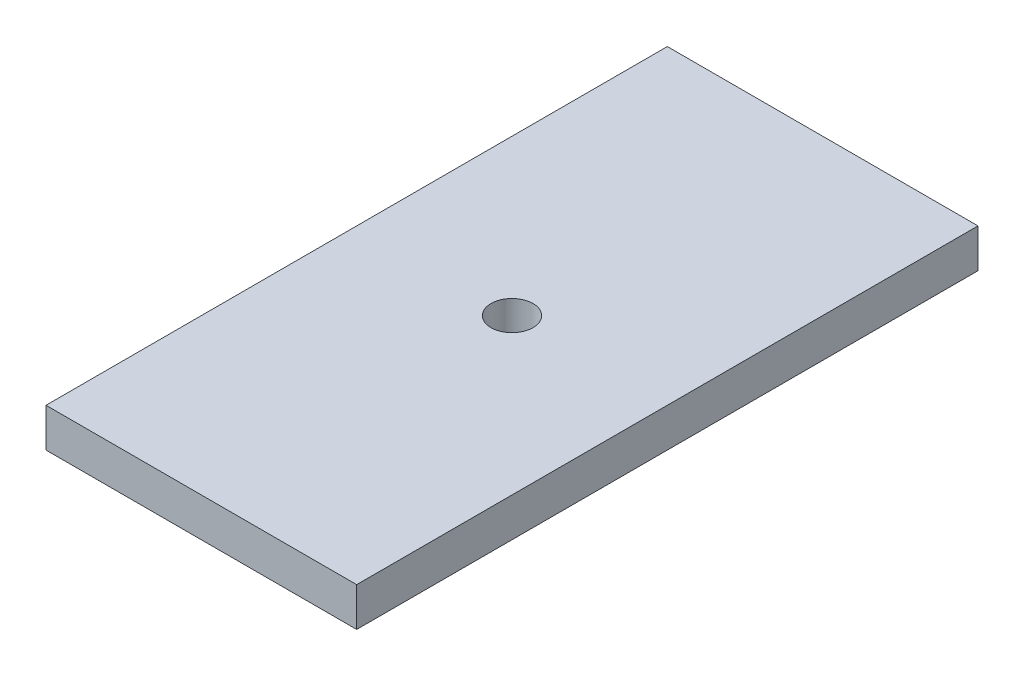
from build123d import *

# Parameters (mm, degrees)
SKETCH1_W           = 50.8
SKETCH1_H           = 101.6
SKETCH1_R           = 3.429
BOSS_EXTRUDE1_DEPTH = 6.35


with BuildPart() as part:
    # Sketch1 → Boss-Extrude1 (new body)
    with BuildSketch(Plane(origin=(0, 0, 0), x_dir=(1, 0, 0), z_dir=(0, 1, 0))):
        Rectangle(SKETCH1_W, SKETCH1_H)
        with Locations(Location((0, 0, 0), (0, 0, 270))):
            Circle(SKETCH1_R, mode=Mode.SUBTRACT)
    extrude(amount=BOSS_EXTRUDE1_DEPTH)


solid = part.part
